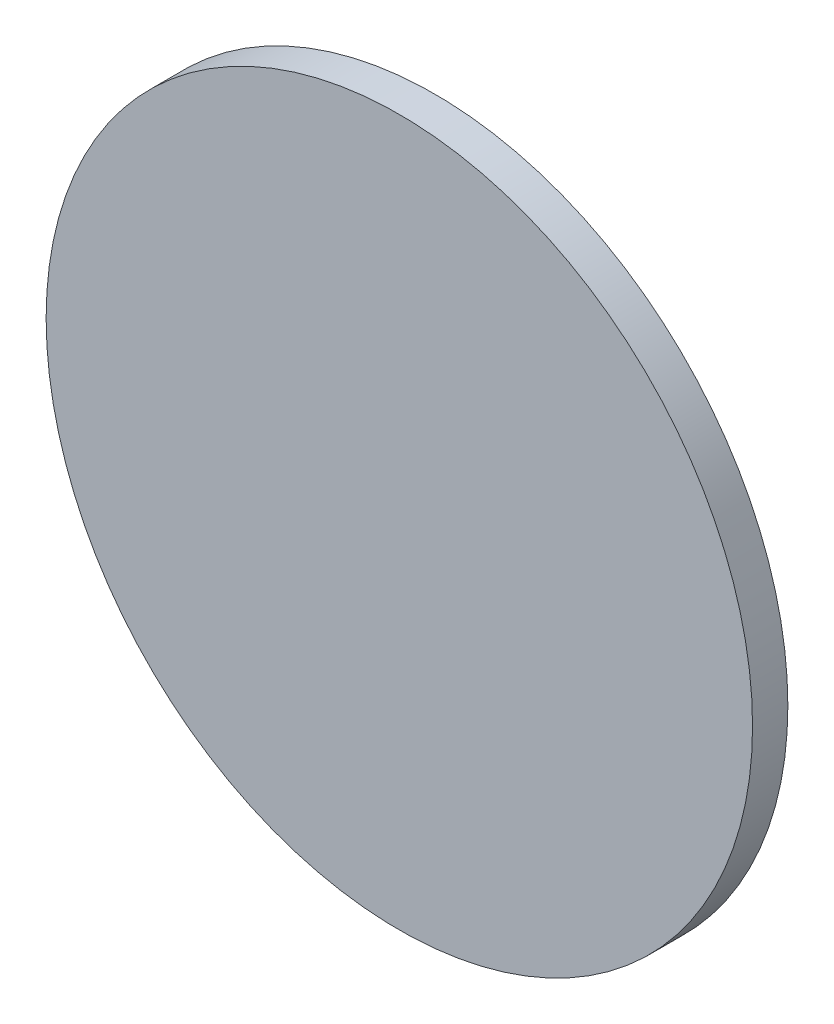
from build123d import *

# Parameters (mm, degrees)
SKETCH1_R           = 40
BOSS_EXTRUDE1_DEPTH = 4


with BuildPart() as part:
    # Sketch1 → Boss-Extrude1 (new body)
    with BuildSketch(Plane.XY):
        Circle(SKETCH1_R)
    extrude(amount=BOSS_EXTRUDE1_DEPTH)


solid = part.part
